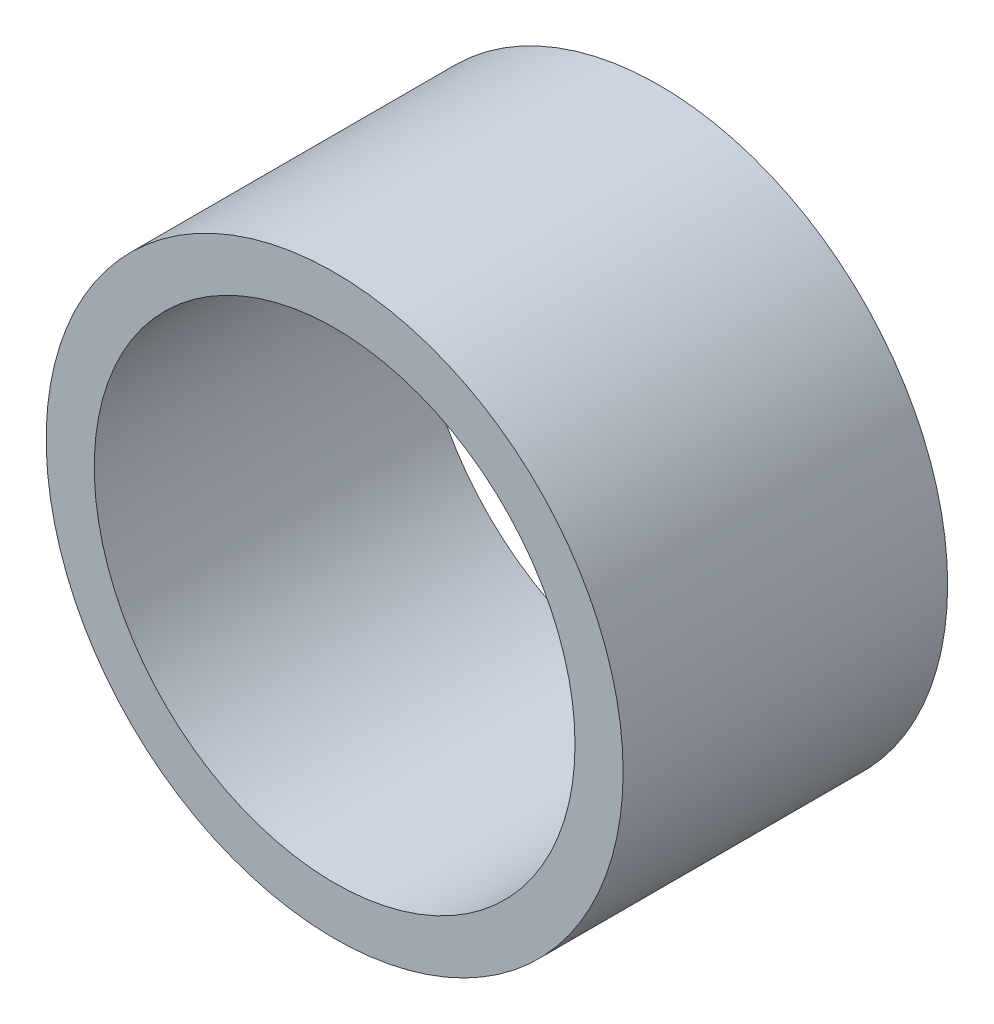
from build123d import *

# Parameters (mm, degrees)
SKETCH_1_R      = 6
SKETCH_1_R_2    = 5
EXTRUDE_1_DEPTH = 6.75


with BuildPart() as part:
    # 草图1 → 凸台-拉伸1 (new body)
    with BuildSketch(Plane.XY):
        Circle(SKETCH_1_R)
        Circle(SKETCH_1_R_2, mode=Mode.SUBTRACT)
    extrude(amount=EXTRUDE_1_DEPTH)


solid = part.part
